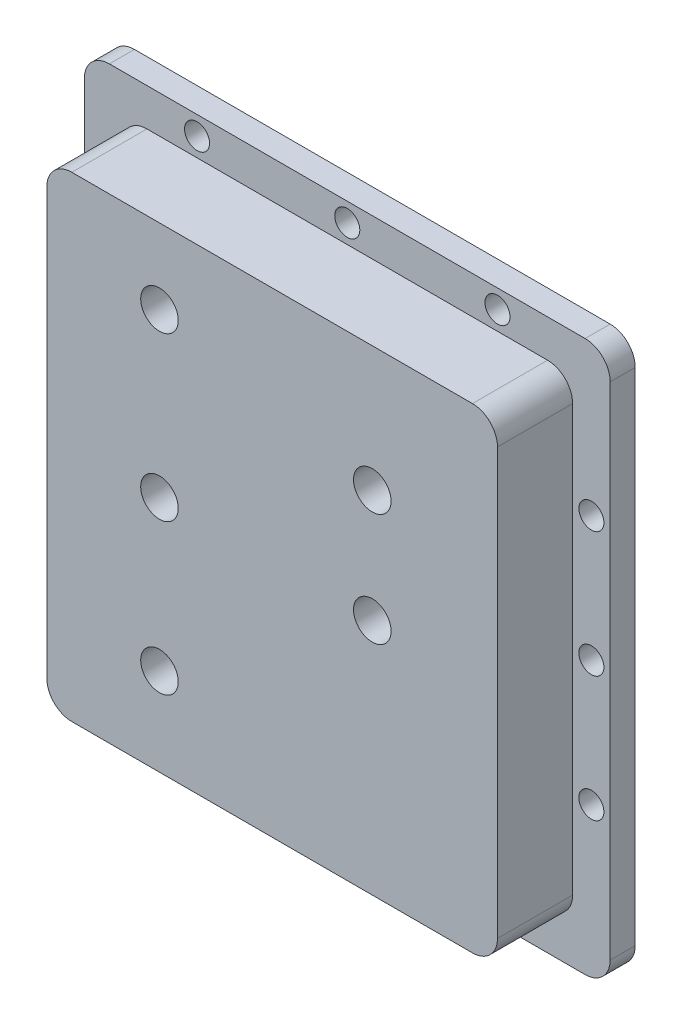
from build123d import *

# Parameters (mm, degrees)
EXTRUDE_1_DEPTH          = 30
SKETCH_2_R               = 5
EXTRUDE_2_DEPTH          = 10
SKETCH_3_W               = 140
SKETCH_3_H               = 160
CUT_EXTRUDE_1_DEPTH      = 10
CUT_EXTRUDE_2_DEPTH      = 158.241851935
CUT_EXTRUDE_2_DEPTH_BACK = 158.241851935
SKETCH_4_R               = 7.5


with BuildPart() as part:
    # 草图1 → 凸台-拉伸1 (new body)
    with BuildSketch(Plane.XY):
        with BuildLine():
            Line((-80, -95), (80, -95))
            ThreePointArc((80, -95), (87.071067812, -92.071067812), (90, -85))
            Line((90, -85), (90, 85))
            ThreePointArc((90, 85), (87.071067812, 92.071067812), (80, 95))
            Line((80, 95), (-80, 95))
            ThreePointArc((-80, 95), (-87.071067812, 92.071067812), (-90, 85))
            Line((-90, 85), (-90, -85))
            ThreePointArc((-90, -85), (-87.071067812, -92.071067812), (-80, -95))
        make_face()
    extrude(amount=EXTRUDE_1_DEPTH)

    # 草图2 → 凸台-拉伸2 (add)
    with BuildSketch(Plane(origin=(0, 0, 0), x_dir=(-1, 0, 0), z_dir=(0, 0, -1))):
        with BuildLine():
            Line((-95, -110), (95, -110))
            ThreePointArc((95, -110), (102.071067812, -107.071067812), (105, -100))
            Line((105, -100), (105, 100))
            ThreePointArc((105, 100), (102.071067812, 107.071067812), (95, 110))
            Line((95, 110), (-95, 110))
            ThreePointArc((-95, 110), (-102.071067812, 107.071067812), (-105, 100))
            Line((-105, 100), (-105, -100))
            ThreePointArc((-105, -100), (-102.071067812, -107.071067812), (-95, -110))
        make_face()
        with Locations((97.5, 0)):
            Circle(SKETCH_2_R, mode=Mode.SUBTRACT)
        with Locations((0, 102.5)):
            Circle(SKETCH_2_R, mode=Mode.SUBTRACT)
        with Locations((60, 102.5)):
            Circle(SKETCH_2_R, mode=Mode.SUBTRACT)
        with Locations((97.5, 50)):
            Circle(SKETCH_2_R, mode=Mode.SUBTRACT)
        with Locations(Location((97.5, -50, 0), (0, 0, 180))):
            Circle(SKETCH_2_R, mode=Mode.SUBTRACT)
        with Locations(Location((60, -102.5, 0), (0, 0, 180))):
            Circle(SKETCH_2_R, mode=Mode.SUBTRACT)
        with Locations(Location((0, -102.5, 0), (0, 0, 180))):
            Circle(SKETCH_2_R, mode=Mode.SUBTRACT)
        with Locations(Location((-60, 102.5, 0), (0, 0, 180))):
            Circle(SKETCH_2_R, mode=Mode.SUBTRACT)
        with Locations((-60, -102.5)):
            Circle(SKETCH_2_R, mode=Mode.SUBTRACT)
        with Locations((-97.5, -50)):
            Circle(SKETCH_2_R, mode=Mode.SUBTRACT)
        with Locations(Location((-97.5, 0, 0), (0, 0, 180))):
            Circle(SKETCH_2_R, mode=Mode.SUBTRACT)
        with Locations(Location((-97.5, 50, 0), (0, 0, 180))):
            Circle(SKETCH_2_R, mode=Mode.SUBTRACT)
    extrude(amount=EXTRUDE_2_DEPTH)

    # 草图3 → 切除-拉伸1 (cut)
    with BuildSketch(Plane(origin=(0, 0, -10), x_dir=(-1, 0, 0), z_dir=(0, 0, -1))):
        Rectangle(SKETCH_3_W, SKETCH_3_H)
    extrude(amount=-CUT_EXTRUDE_1_DEPTH, mode=Mode.SUBTRACT)

    # 草图4 → 切除-拉伸2 (cut, two sides: drawn at the far end of the back side and taken through both)
    with BuildSketch(Plane.XY.offset(30).offset(-CUT_EXTRUDE_2_DEPTH_BACK)):
        with Locations(Location((40, 45, 0), (0, 0, 180))):
            Circle(SKETCH_4_R)
        with Locations(Location((40, 0, 0), (0, 0, 180))):
            Circle(SKETCH_4_R)
        with Locations(Location((-45, 0, 0), (0, 0, 180))):
            Circle(SKETCH_4_R)
        with Locations(Location((-45, 65, 0), (0, 0, 180))):
            Circle(SKETCH_4_R)
        with Locations(Location((-45, -60, 0), (0, 0, 180))):
            Circle(SKETCH_4_R)
    extrude(amount=CUT_EXTRUDE_2_DEPTH + CUT_EXTRUDE_2_DEPTH_BACK, mode=Mode.SUBTRACT)


solid = part.part
